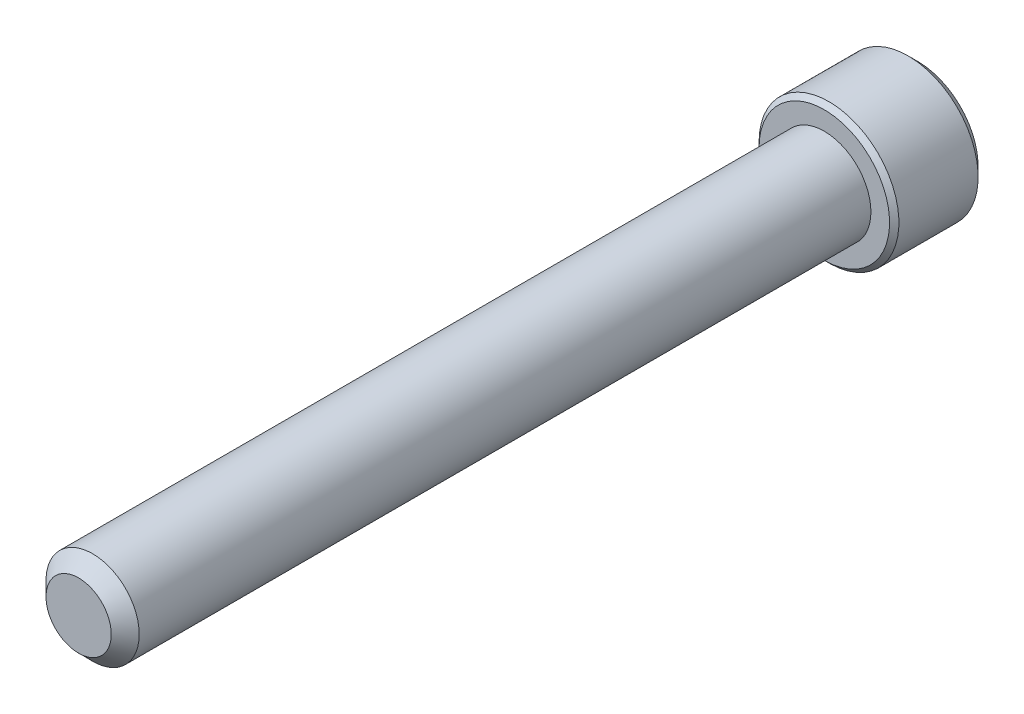
from build123d import *

# Parameters (mm, degrees)
SKETCH1_R          = 3.175
EXTRUDE1_DEPTH     = 50.8
CHAMFER3_SIZE      = 0.9525
SKETCH6_R          = 4.7625
EXTRUDE2_DEPTH     = 6.35
CUT_EXTRUDE1_DEPTH = 3.571875
SKETCH8_R          = 2.749630657
CUT_EXTRUDE2_DEPTH = 0.635
CUT_EXTRUDE2_DRAFT = -45
CHAMFER1_SIZE      = 0.635
CHAMFER2_SIZE      = 0.3175


with BuildPart() as part:
    # Sketch1 → Extrude1 (new body)
    with BuildSketch(Plane.XY):
        Circle(SKETCH1_R)
    extrude(amount=-EXTRUDE1_DEPTH)

    # Chamfer3
    chamfer3_edges = [part.edges().sort_by_distance(p)[0] for p in [
        (-3.175, 0, 0),
    ]]
    chamfer(chamfer3_edges, length=CHAMFER3_SIZE)

    # Sketch5 → partially thread (revolve)
    with BuildSketch(Plane(origin=(0, 0, 0), x_dir=(0, 0, -1), z_dir=(1, 0, 0))):
        Polygon((50.8, 3.175), (25.4, 3.175), (22.225, 0), (25.4, 0), (50.8, 0), align=None)
    revolve(axis=Axis((0, 0, 0), (0, 0, -1)))

    # Sketch6 → Extrude2 (add)
    with BuildSketch(Plane(origin=(0, 0, -50.8), x_dir=(-1, 0, 0), z_dir=(0, 0, -1))):
        Circle(SKETCH6_R)
    extrude(amount=EXTRUDE2_DEPTH)

    # Sketch7 → Cut-Extrude1 (cut)
    with BuildSketch(Plane(origin=(0, 0, -57.15), x_dir=(-1, 0, 0), z_dir=(0, 0, -1))):
        Polygon((0, 2.749630657), (-2.38125, 1.374815329), (-2.38125, -1.374815329), (0, -2.749630657), (2.38125, -1.374815329), (2.38125, 1.374815329), align=None)
    extrude(amount=-CUT_EXTRUDE1_DEPTH, mode=Mode.SUBTRACT)


with BuildPart() as cut_extrude2_tool:
    # Sketch8 → Cut-Extrude2 (with draft: the straight prism first)
    with BuildSketch(Plane(origin=(0, 0, -57.15), x_dir=(-1, 0, 0), z_dir=(0, 0, -1))):
        Circle(SKETCH8_R)
    extrude(amount=-CUT_EXTRUDE2_DEPTH)
    # Cut-Extrude2: the draft: its side faces are tilted about the plane it starts from
    cut_extrude2_sides = [cut_extrude2_tool.faces().sort_by_distance(p)[0] for p in [
        (2.749630657, 0, -56.8325),
    ]]
    draft(cut_extrude2_sides, Plane(origin=(0, 0, -57.15), x_dir=(-1, 0, 0), z_dir=(0, 0, -1)), CUT_EXTRUDE2_DRAFT)


with BuildPart() as part_1:
    add(part.part)

    # Cut-Extrude2: cut by cut_extrude2_tool
    add(cut_extrude2_tool.part, mode=Mode.SUBTRACT)

    # Chamfer1
    chamfer1_edges = [part_1.edges().sort_by_distance(p)[0] for p in [
        (4.7625, 0, -57.15),
    ]]
    chamfer(chamfer1_edges, length=CHAMFER1_SIZE)

    # Chamfer2
    chamfer2_edges = [part_1.edges().sort_by_distance(p)[0] for p in [
        (4.7625, 0, -50.8),
    ]]
    chamfer(chamfer2_edges, length=CHAMFER2_SIZE)


solid = part_1.part
